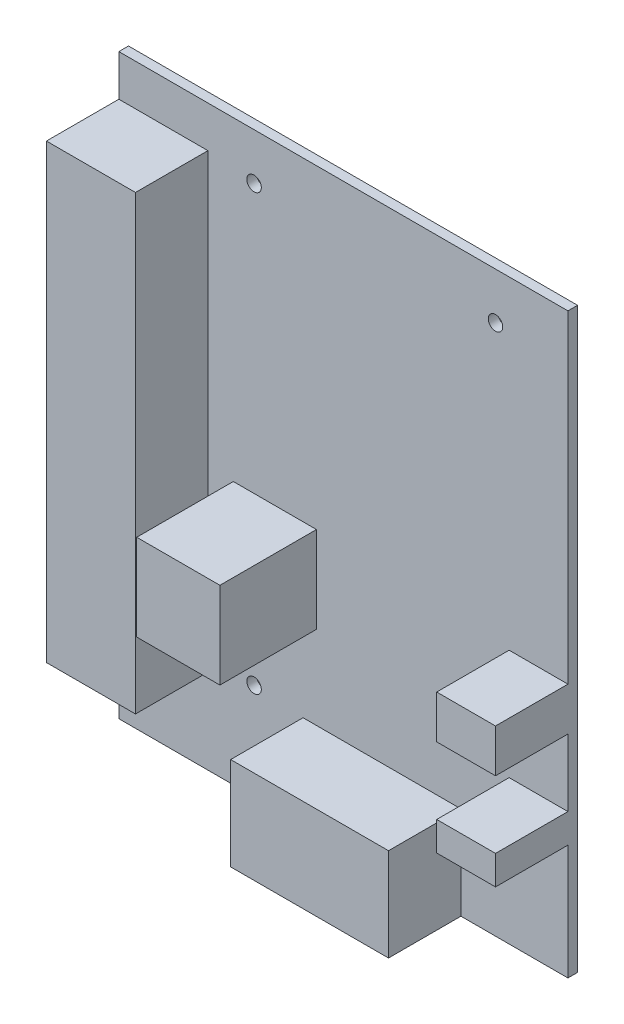
from build123d import *

# Parameters (mm, degrees)
SKETCH_1_R      = 1.5
EXTRUDE_1_DEPTH = 2
SKETCH_2_W      = 18.445036106
SKETCH_2_H      = 93.536016732
SKETCH_2_W_2    = 32.694926102
SKETCH_2_H_2    = 19.252727105
SKETCH_2_W_3    = 12.175605479
SKETCH_2_H_3    = 8.939965333
SKETCH_2_H_4    = 6.01746804
EXTRUDE_2_DEPTH = 15
SKETCH_3_W      = 17.224530095
SKETCH_3_H      = 17.900793214
EXTRUDE_3_DEPTH = 20


with BuildPart() as part:
    # 草图1 → 凸台-拉伸1 (new body)
    with BuildSketch(Plane.XY):
        Polygon((-66.211382114, 42.479674797), (-66.211382114, -47.520325203), (-66.211382114, -67.520325203), (11.788617886, -67.520325203), (26.788617886, -67.520325203), (26.788617886, 42.479674797), (26.788617886, 52.131300798), (-66.211382114, 52.131300798), align=None)
        with Locations((-38.211382114, 42.479674797)):
            Circle(SKETCH_1_R, mode=Mode.SUBTRACT)
        with Locations((11.788617886, 42.479674797)):
            Circle(SKETCH_1_R, mode=Mode.SUBTRACT)
        with Locations((11.788617886, -47.520325203)):
            Circle(SKETCH_1_R, mode=Mode.SUBTRACT)
        with Locations((-38.211382114, -47.520325203)):
            Circle(SKETCH_1_R, mode=Mode.SUBTRACT)
    extrude(amount=EXTRUDE_1_DEPTH)

    # 草图2 → 凸台-拉伸2 (add)
    with BuildSketch(Plane.XY.offset(2)):
        with Locations((-56.988864061, -3.180525851)):
            Rectangle(SKETCH_2_W, SKETCH_2_H)
        with Locations((-11.714742976, -57.893961651)):
            Rectangle(SKETCH_2_W_2, SKETCH_2_H_2)
        with Locations((20.700815147, -19.289017999)):
            Rectangle(SKETCH_2_W_3, SKETCH_2_H_3)
        with Locations((20.700815147, -40.681085502)):
            Rectangle(SKETCH_2_W_3, SKETCH_2_H_4)
    extrude(amount=EXTRUDE_2_DEPTH)

    # 草图3 → 凸台-拉伸3 (add)
    with BuildSketch(Plane.XY.offset(2)):
        with Locations((-33.897142446, -22.073097892)):
            Rectangle(SKETCH_3_W, SKETCH_3_H)
    extrude(amount=EXTRUDE_3_DEPTH)


solid = part.part
